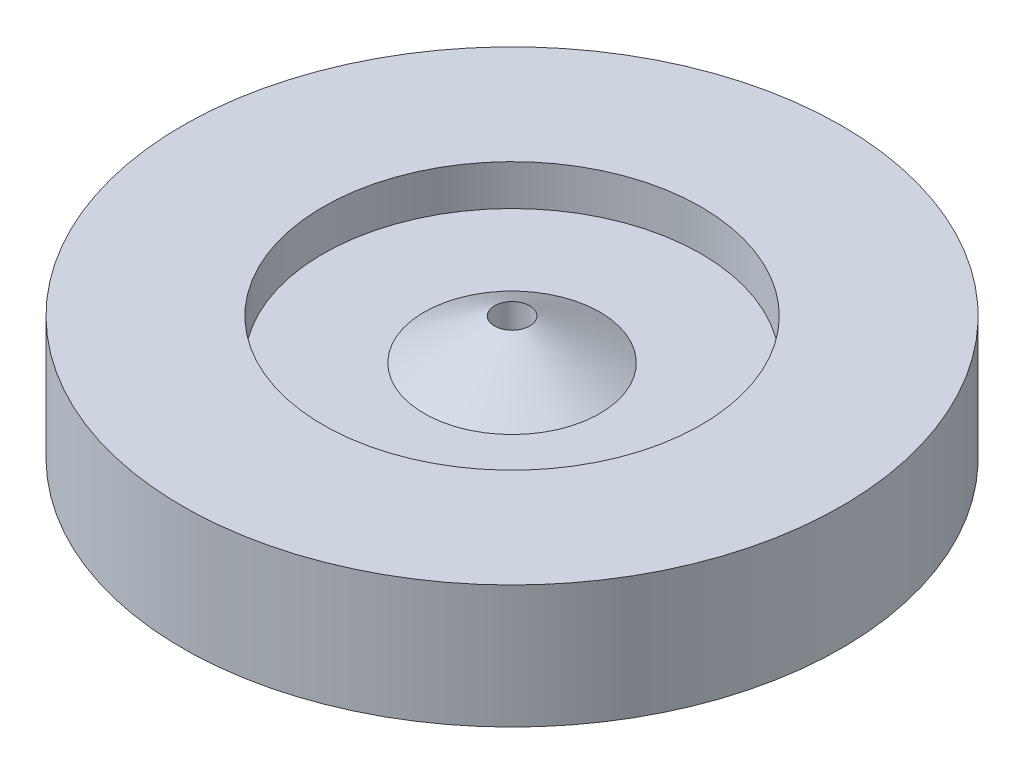
from build123d import *


with BuildPart() as part:
    # 스케치1 → 회전1 (revolve)
    with BuildSketch(Plane(origin=(0, 0, 0), x_dir=(0, 0, -1), z_dir=(1, 0, 0))):
        Polygon((10, 35), (10, -35), (50, -11.905989232), (107.5, -11.905989232), (107.5, -35), (187.5, -35), (187.5, 35), (107.5, 35), (107.5, 11.905989232), (50, 11.905989232), align=None)
    revolve(axis=Axis((0, 0, 0), (0, 1, 0)))


solid = part.part
